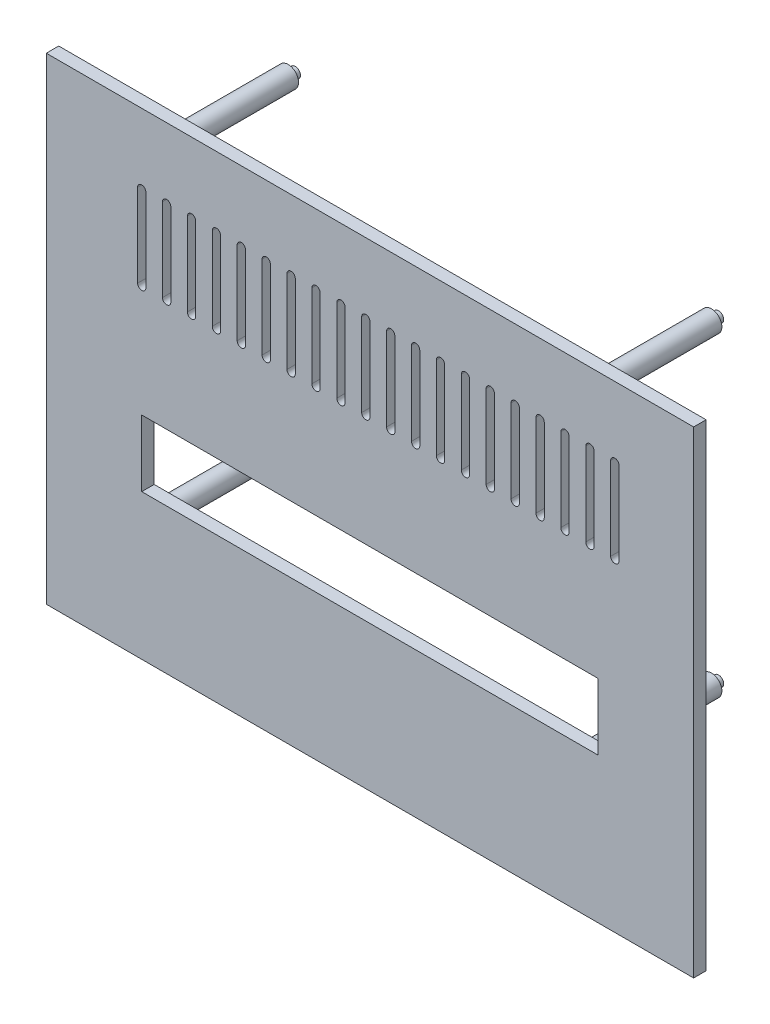
from build123d import *

# Parameters (mm, degrees)
SKETCH_2_W      = 156
SKETCH_2_H      = 115
SKETCH_2_W_2    = 110
SKETCH_2_H_2    = 16
EXTRUDE_1_DEPTH = 3
SKETCH_1_W      = 150
SKETCH_1_H      = 110
SKETCH_1_W_2    = 144
SKETCH_1_H_2    = 104
EXTRUDE_2_DEPTH = 2
SKETCH_3_R      = 2.5
EXTRUDE_3_DEPTH = 28.3
SKETCH_5_R      = 1.25
EXTRUDE_4_DEPTH = 1.7


with BuildPart() as part:
    # 草图2 → 凸台-拉伸1 (new body)
    with BuildSketch(Plane.XY.offset(-2087.481675365)):
        with Locations((145.628836913, 15.276761468)):
            Rectangle(SKETCH_2_W, SKETCH_2_H)
        with Locations((145.628836913, 0.776761468)):
            Rectangle(SKETCH_2_W_2, SKETCH_2_H_2, mode=Mode.SUBTRACT)
        with BuildLine():
            Line((89.628836913, 35.776761468), (89.628836913, 55.776761468))
            ThreePointArc((89.628836913, 55.776761468), (90.628836913, 56.776761468), (91.628836913, 55.776761468))
            Line((91.628836913, 55.776761468), (91.628836913, 35.776761468))
            ThreePointArc((91.628836913, 35.776761468), (90.628836913, 34.776761468), (89.628836913, 35.776761468))
        make_face(mode=Mode.SUBTRACT)
        with BuildLine():
            Line((95.628836913, 35.776761468), (95.628836913, 55.776761468))
            ThreePointArc((95.628836913, 55.776761468), (96.628836913, 56.776761468), (97.628836913, 55.776761468))
            Line((97.628836913, 55.776761468), (97.628836913, 35.776761468))
            ThreePointArc((97.628836913, 35.776761468), (96.628836913, 34.776761468), (95.628836913, 35.776761468))
        make_face(mode=Mode.SUBTRACT)
        with BuildLine():
            Line((101.628836913, 35.776761468), (101.628836913, 55.776761468))
            ThreePointArc((101.628836913, 55.776761468), (102.628836913, 56.776761468), (103.628836913, 55.776761468))
            Line((103.628836913, 55.776761468), (103.628836913, 35.776761468))
            ThreePointArc((103.628836913, 35.776761468), (102.628836913, 34.776761468), (101.628836913, 35.776761468))
        make_face(mode=Mode.SUBTRACT)
        with BuildLine():
            Line((107.628836913, 35.776761468), (107.628836913, 55.776761468))
            ThreePointArc((107.628836913, 55.776761468), (108.628836913, 56.776761468), (109.628836913, 55.776761468))
            Line((109.628836913, 55.776761468), (109.628836913, 35.776761468))
            ThreePointArc((109.628836913, 35.776761468), (108.628836913, 34.776761468), (107.628836913, 35.776761468))
        make_face(mode=Mode.SUBTRACT)
        with BuildLine():
            Line((113.628836913, 35.776761468), (113.628836913, 55.776761468))
            ThreePointArc((113.628836913, 55.776761468), (114.628836913, 56.776761468), (115.628836913, 55.776761468))
            Line((115.628836913, 55.776761468), (115.628836913, 35.776761468))
            ThreePointArc((115.628836913, 35.776761468), (114.628836913, 34.776761468), (113.628836913, 35.776761468))
        make_face(mode=Mode.SUBTRACT)
        with BuildLine():
            Line((119.628836913, 35.776761468), (119.628836913, 55.776761468))
            ThreePointArc((119.628836913, 55.776761468), (120.628836913, 56.776761468), (121.628836913, 55.776761468))
            Line((121.628836913, 55.776761468), (121.628836913, 35.776761468))
            ThreePointArc((121.628836913, 35.776761468), (120.628836913, 34.776761468), (119.628836913, 35.776761468))
        make_face(mode=Mode.SUBTRACT)
        with BuildLine():
            Line((125.628836913, 35.776761468), (125.628836913, 55.776761468))
            ThreePointArc((125.628836913, 55.776761468), (126.628836913, 56.776761468), (127.628836913, 55.776761468))
            Line((127.628836913, 55.776761468), (127.628836913, 35.776761468))
            ThreePointArc((127.628836913, 35.776761468), (126.628836913, 34.776761468), (125.628836913, 35.776761468))
        make_face(mode=Mode.SUBTRACT)
        with BuildLine():
            Line((131.628836913, 35.776761468), (131.628836913, 55.776761468))
            ThreePointArc((131.628836913, 55.776761468), (132.628836913, 56.776761468), (133.628836913, 55.776761468))
            Line((133.628836913, 55.776761468), (133.628836913, 35.776761468))
            ThreePointArc((133.628836913, 35.776761468), (132.628836913, 34.776761468), (131.628836913, 35.776761468))
        make_face(mode=Mode.SUBTRACT)
        with BuildLine():
            Line((137.628836913, 35.776761468), (137.628836913, 55.776761468))
            ThreePointArc((137.628836913, 55.776761468), (138.628836913, 56.776761468), (139.628836913, 55.776761468))
            Line((139.628836913, 55.776761468), (139.628836913, 35.776761468))
            ThreePointArc((139.628836913, 35.776761468), (138.628836913, 34.776761468), (137.628836913, 35.776761468))
        make_face(mode=Mode.SUBTRACT)
        with BuildLine():
            Line((143.628836913, 35.776761468), (143.628836913, 55.776761468))
            ThreePointArc((143.628836913, 55.776761468), (144.628836913, 56.776761468), (145.628836913, 55.776761468))
            Line((145.628836913, 55.776761468), (145.628836913, 35.776761468))
            ThreePointArc((145.628836913, 35.776761468), (144.628836913, 34.776761468), (143.628836913, 35.776761468))
        make_face(mode=Mode.SUBTRACT)
        with BuildLine():
            Line((149.628836913, 35.776761468), (149.628836913, 55.776761468))
            ThreePointArc((149.628836913, 55.776761468), (150.628836913, 56.776761468), (151.628836913, 55.776761468))
            Line((151.628836913, 55.776761468), (151.628836913, 35.776761468))
            ThreePointArc((151.628836913, 35.776761468), (150.628836913, 34.776761468), (149.628836913, 35.776761468))
        make_face(mode=Mode.SUBTRACT)
        with BuildLine():
            Line((155.628836913, 35.776761468), (155.628836913, 55.776761468))
            ThreePointArc((155.628836913, 55.776761468), (156.628836913, 56.776761468), (157.628836913, 55.776761468))
            Line((157.628836913, 55.776761468), (157.628836913, 35.776761468))
            ThreePointArc((157.628836913, 35.776761468), (156.628836913, 34.776761468), (155.628836913, 35.776761468))
        make_face(mode=Mode.SUBTRACT)
        with BuildLine():
            Line((161.628836913, 35.776761468), (161.628836913, 55.776761468))
            ThreePointArc((161.628836913, 55.776761468), (162.628836913, 56.776761468), (163.628836913, 55.776761468))
            Line((163.628836913, 55.776761468), (163.628836913, 35.776761468))
            ThreePointArc((163.628836913, 35.776761468), (162.628836913, 34.776761468), (161.628836913, 35.776761468))
        make_face(mode=Mode.SUBTRACT)
        with BuildLine():
            Line((167.628836913, 35.776761468), (167.628836913, 55.776761468))
            ThreePointArc((167.628836913, 55.776761468), (168.628836913, 56.776761468), (169.628836913, 55.776761468))
            Line((169.628836913, 55.776761468), (169.628836913, 35.776761468))
            ThreePointArc((169.628836913, 35.776761468), (168.628836913, 34.776761468), (167.628836913, 35.776761468))
        make_face(mode=Mode.SUBTRACT)
        with BuildLine():
            Line((173.628836913, 35.776761468), (173.628836913, 55.776761468))
            ThreePointArc((173.628836913, 55.776761468), (174.628836913, 56.776761468), (175.628836913, 55.776761468))
            Line((175.628836913, 55.776761468), (175.628836913, 35.776761468))
            ThreePointArc((175.628836913, 35.776761468), (174.628836913, 34.776761468), (173.628836913, 35.776761468))
        make_face(mode=Mode.SUBTRACT)
        with BuildLine():
            Line((179.628836913, 35.776761468), (179.628836913, 55.776761468))
            ThreePointArc((179.628836913, 55.776761468), (180.628836913, 56.776761468), (181.628836913, 55.776761468))
            Line((181.628836913, 55.776761468), (181.628836913, 35.776761468))
            ThreePointArc((181.628836913, 35.776761468), (180.628836913, 34.776761468), (179.628836913, 35.776761468))
        make_face(mode=Mode.SUBTRACT)
        with BuildLine():
            Line((185.628836913, 35.776761468), (185.628836913, 55.776761468))
            ThreePointArc((185.628836913, 55.776761468), (186.628836913, 56.776761468), (187.628836913, 55.776761468))
            Line((187.628836913, 55.776761468), (187.628836913, 35.776761468))
            ThreePointArc((187.628836913, 35.776761468), (186.628836913, 34.776761468), (185.628836913, 35.776761468))
        make_face(mode=Mode.SUBTRACT)
        with BuildLine():
            Line((191.628836913, 35.776761468), (191.628836913, 55.776761468))
            ThreePointArc((191.628836913, 55.776761468), (192.628836913, 56.776761468), (193.628836913, 55.776761468))
            Line((193.628836913, 55.776761468), (193.628836913, 35.776761468))
            ThreePointArc((193.628836913, 35.776761468), (192.628836913, 34.776761468), (191.628836913, 35.776761468))
        make_face(mode=Mode.SUBTRACT)
        with BuildLine():
            Line((197.628836913, 35.776761468), (197.628836913, 55.776761468))
            ThreePointArc((197.628836913, 55.776761468), (198.628836913, 56.776761468), (199.628836913, 55.776761468))
            Line((199.628836913, 55.776761468), (199.628836913, 35.776761468))
            ThreePointArc((199.628836913, 35.776761468), (198.628836913, 34.776761468), (197.628836913, 35.776761468))
        make_face(mode=Mode.SUBTRACT)
        with BuildLine():
            Line((203.628836913, 35.776761468), (203.628836913, 55.776761468))
            ThreePointArc((203.628836913, 55.776761468), (204.628836913, 56.776761468), (205.628836913, 55.776761468))
            Line((205.628836913, 55.776761468), (205.628836913, 35.776761468))
            ThreePointArc((205.628836913, 35.776761468), (204.628836913, 34.776761468), (203.628836913, 35.776761468))
        make_face(mode=Mode.SUBTRACT)
    extrude(amount=EXTRUDE_1_DEPTH)

    # 草图1 → 凸台-拉伸2 (add)
    with BuildSketch(Plane.XY.offset(-2087.481675365)):
        with Locations((145.628836913, 15.776761468)):
            Rectangle(SKETCH_1_W, SKETCH_1_H)
        with Locations((145.628836913, 15.776761468)):
            Rectangle(SKETCH_1_W_2, SKETCH_1_H_2, mode=Mode.SUBTRACT)
    extrude(amount=-EXTRUDE_2_DEPTH)

    # 草图3 → 凸台-拉伸3 (add)
    with BuildSketch(Plane(origin=(0, 0, -2087.481675365), x_dir=(-1, 0, 0), z_dir=(0, 0, -1))):
        with Locations(Location((-196.628836913, 65.776761468, 0), (0, 0, 126.869897646))):
            Circle(SKETCH_3_R)
        with Locations(Location((-94.628836913, 65.776761468, 0), (0, 0, 126.869897646))):
            Circle(SKETCH_3_R)
        with Locations(Location((-94.628836913, -10.223238532, 0), (0, 0, 180))):
            Circle(SKETCH_3_R)
        with Locations(Location((-196.628836913, -10.223238532, 0), (0, 0, 180))):
            Circle(SKETCH_3_R)
    extrude(amount=EXTRUDE_3_DEPTH)

    # 草图5 → 凸台-拉伸4 (add)
    with BuildSketch(Plane(origin=(0, 0, -2115.781675365), x_dir=(-1, 0, 0), z_dir=(0, 0, -1))):
        with Locations((-196.628836913, 65.776761468)):
            Circle(SKETCH_5_R)
        with Locations((-94.628836913, 65.776761468)):
            Circle(SKETCH_5_R)
        with Locations((-94.628836913, -10.223238532)):
            Circle(SKETCH_5_R)
        with Locations((-196.628836913, -10.223238532)):
            Circle(SKETCH_5_R)
    extrude(amount=EXTRUDE_4_DEPTH)


solid = part.part
